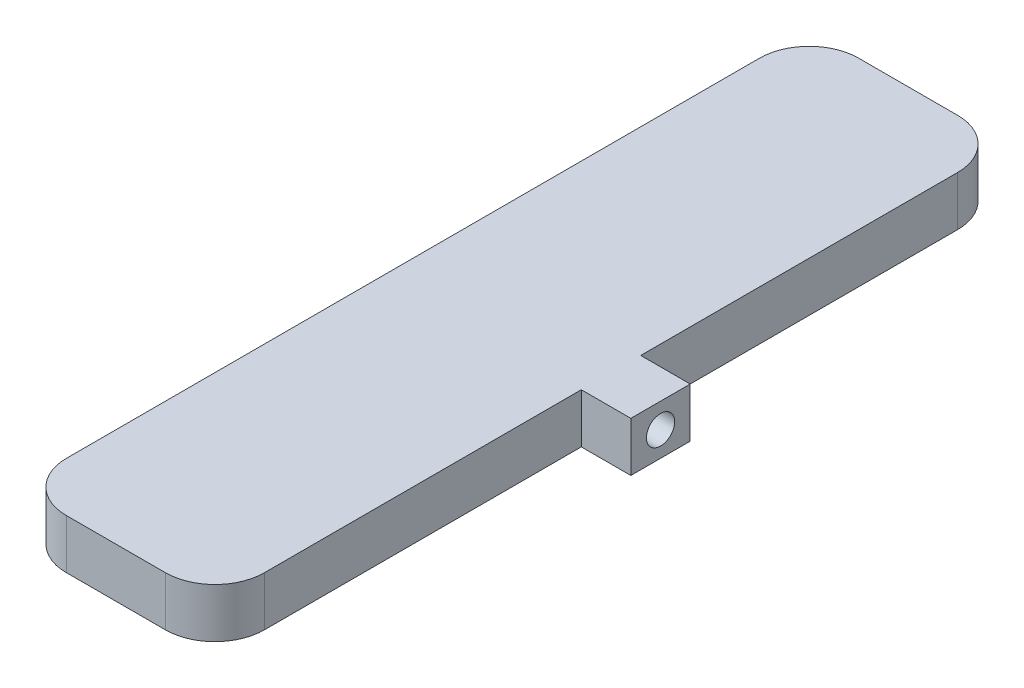
from build123d import *

# Parameters (mm, degrees)
SKETCH1_W           = 20
SKETCH1_H           = 80
BOSS_EXTRUDE1_DEPTH = 5
FILLET1_R           = 5
SHELL1_T            = -2
SKETCH2_W           = 6
SKETCH2_H           = 5
BOSS_EXTRUDE2_DEPTH = 5
SKETCH3_R           = 1.425
CUT_EXTRUDE1_DEPTH  = 4


with BuildPart() as part:
    # Sketch1 → Boss-Extrude1 (new body)
    with BuildSketch(Plane(origin=(0, 0, 0), x_dir=(1, 0, 0), z_dir=(0, 1, 0))):
        Rectangle(SKETCH1_W, SKETCH1_H)
    extrude(amount=BOSS_EXTRUDE1_DEPTH)

    # Fillet1
    fillet1_edges = [part.edges().sort_by_distance(p)[0] for p in [
        (10, 2.5, 40),
        (-10, 2.5, 40),
        (-10, 2.5, -40),
        (10, 2.5, -40),
    ]]
    fillet(fillet1_edges, radius=FILLET1_R)

    # Shell1
    shell1_openings = [part.faces().sort_by_distance(p)[0] for p in [
        (0, 0, 0),
    ]]
    offset(amount=SHELL1_T, openings=shell1_openings, kind=Kind.INTERSECTION)

    # Sketch2 → Boss-Extrude2 (add)
    with BuildSketch(Plane(origin=(10, 0, 0), x_dir=(0, 0, -1), z_dir=(1, 0, 0))):
        with Locations((0, 2.5)):
            Rectangle(SKETCH2_W, SKETCH2_H)
    extrude(amount=BOSS_EXTRUDE2_DEPTH)

    # Sketch3 → Cut-Extrude1 (cut)
    with BuildSketch(Plane(origin=(15, 0, 0), x_dir=(0, 0, -1), z_dir=(1, 0, 0))):
        with Locations((0, 2.5)):
            Circle(SKETCH3_R)
    extrude(amount=-CUT_EXTRUDE1_DEPTH, mode=Mode.SUBTRACT)


solid = part.part
